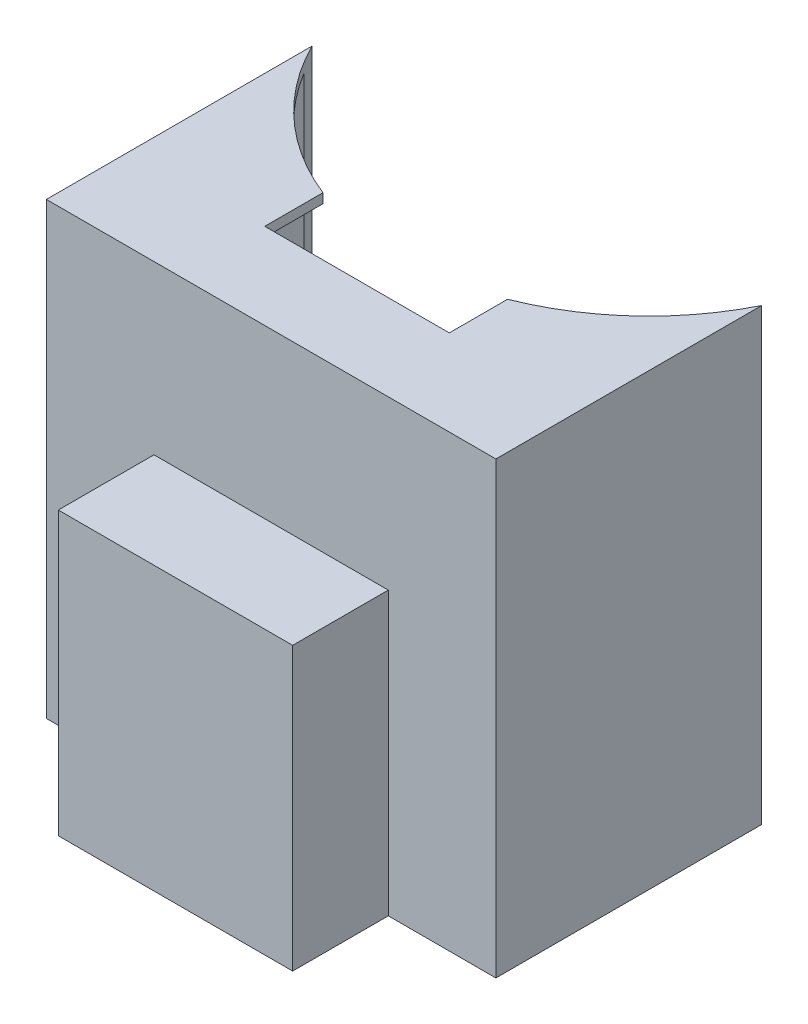
from build123d import *

# Parameters (mm, degrees)
BOSS_EXTRU_1_START = -10
BOSS_EXTRU_1_DEPTH = 2
BOSS_EXTRU_2_START = -12
BOSS_EXTRU_2_DEPTH = 20
BOSS_EXTRU_3_START = -32
ESQUISSE3_4_W      = 45
ESQUISSE3_4_H      = 57
BOSS_EXTRU_3_DEPTH = 2
BOSS_EXTRU_4_DEPTH = 2
BOSS_EXTRU_5_DEPTH = 94


with BuildPart() as part:
    # Esquisse3 → Boss.-Extru.1 (new body)
    with BuildSketch(Plane(origin=(0, 0, 66.961524227), x_dir=(-1, 0, 0), z_dir=(0, 0, -1)).offset(BOSS_EXTRU_1_START)):
        Polygon((47, -2), (47, 92), (-47, 92), (-47, -2), (-24.5, -2), (-24.5, 57), (24.5, 57), (24.5, -2), align=None)
        Polygon((22.5, -2), (24.5, -2), (24.5, 57), (-24.5, 57), (-24.5, -2), (-22.5, -2), (-22.5, 55), (22.5, 55), align=None)
    extrude(amount=-BOSS_EXTRU_1_DEPTH)

    # Esquisse3<3> → Boss.-Extru.2 (add)
    with BuildSketch(Plane(origin=(0, 0, 66.961524227), x_dir=(-1, 0, 0), z_dir=(0, 0, -1)).offset(BOSS_EXTRU_2_START)):
        Polygon((22.5, -2), (24.5, -2), (24.5, 57), (-24.5, 57), (-24.5, -2), (-22.5, -2), (-22.5, 55), (22.5, 55), align=None)
    extrude(amount=-BOSS_EXTRU_2_DEPTH)

    # Esquisse3<4> → Boss.-Extru.3 (add)
    with BuildSketch(Plane(origin=(0, 0, 66.961524227), x_dir=(-1, 0, 0), z_dir=(0, 0, -1)).offset(BOSS_EXTRU_3_START)):
        with Locations((0, 26.5)):
            Rectangle(ESQUISSE3_4_W, ESQUISSE3_4_H)
    extrude(amount=BOSS_EXTRU_3_DEPTH)

    # Esquisse4 → Boss.-Extru.4 (add)
    with BuildSketch(Plane(origin=(0, 92, 0), x_dir=(1, 0, 0), z_dir=(0, 1, 0))):
        with BuildLine():
            Line((-45, -27.041634566), (-45, -76.961524227))
            Line((-45, -76.961524227), (45, -76.961524227))
            Line((45, -76.961524227), (45, -27.041634566))
            ThreePointArc((45, -27.041634566), (33.944628417, -40.050121119), (19.3, -48.823764705))
            Line((19.3, -48.823764705), (19.3, -61.001524227))
            Line((19.3, -61.001524227), (-19.3, -61.001524227))
            Line((-19.3, -61.001524227), (-19.3, -48.823764705))
            ThreePointArc((-19.3, -48.823764705), (-33.944628417, -40.050121119), (-45, -27.041634566))
        make_face()
    extrude(amount=-BOSS_EXTRU_4_DEPTH)

    # Esquisse4<3> → Boss.-Extru.5 (add)
    with BuildSketch(Plane(origin=(0, 92, 0), x_dir=(1, 0, 0), z_dir=(0, 1, 0))):
        with BuildLine():
            Line((45, -27.041634566), (45, -76.961524227))
            Line((45, -76.961524227), (47, -76.961524227))
            Line((47, -76.961524227), (47, -23.393375131))
            ThreePointArc((47, -23.393375131), (46.036153719, -25.237324557), (45, -27.041634566))
        make_face()
        with BuildLine():
            ThreePointArc((-47, -23.393375131), (-46.036153719, -25.237324557), (-45, -27.041634566))
            Line((-45, -27.041634566), (-45, -76.961524227))
            Line((-45, -76.961524227), (-47, -76.961524227))
            Line((-47, -76.961524227), (-47, -23.393375131))
        make_face()
    extrude(amount=-BOSS_EXTRU_5_DEPTH)


solid = part.part
